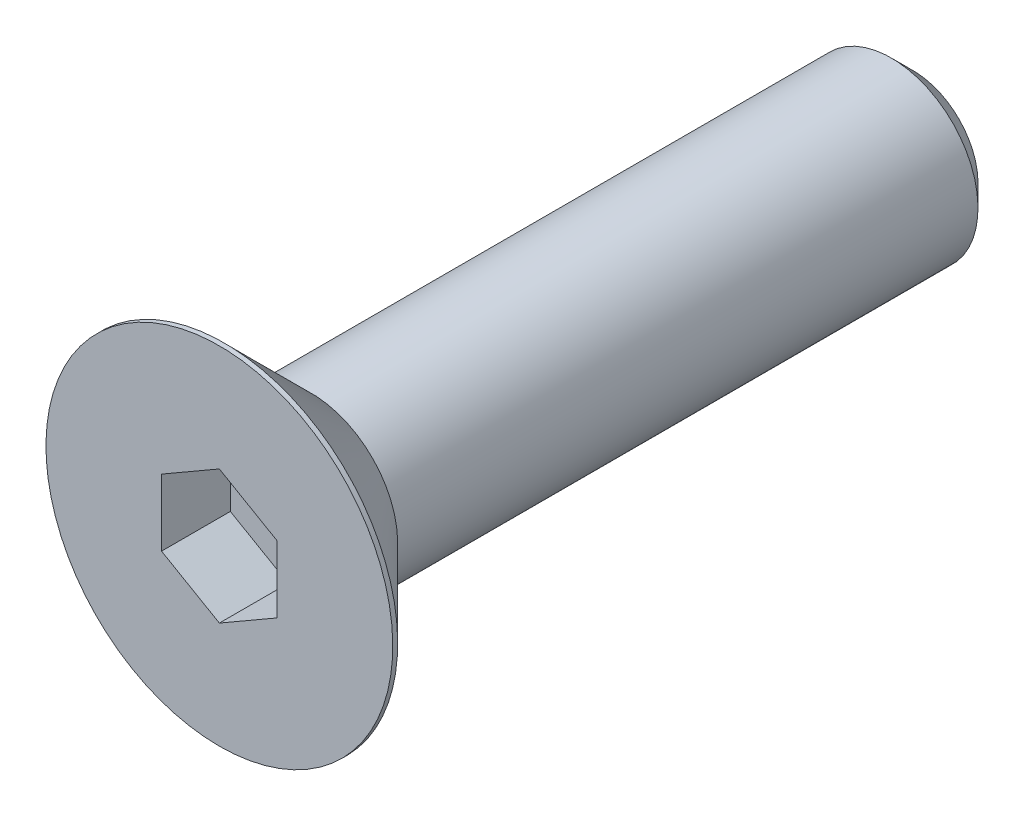
from build123d import *

# Parameters (mm, degrees)
CHAMFER1_SIZE      = 0.375
CUT_EXTRUDE2_DEPTH = 1.19


with BuildPart() as part:
    # Sketch1 → Revolve1 (revolve)
    with BuildSketch(Plane(origin=(0, 0, 0), x_dir=(0, 0, -1), z_dir=(1, 0, 0))):
        Polygon((-4.3, 1.5), (6, 1.5), (6, 0), (-4.81, 0), (-4.81, 1.5), align=None)
    revolve(axis=Axis((0, 0, 4.81), (0, 0, -1)))

    # Chamfer1
    chamfer1_edges = [part.edges().sort_by_distance(p)[0] for p in [
        (0, -1.5, -6),
    ]]
    chamfer(chamfer1_edges, length=CHAMFER1_SIZE)


with BuildPart() as body_2:
    # Sketch7 → Revolve2 (revolve)
    with BuildSketch(Plane(origin=(0, 0, 0), x_dir=(0, 0, -1), z_dir=(1, 0, 0))):
        Polygon((-5.915, 3), (-6, 3), (-6, 0), (-4.3, 0), (-4.3, 1.385), align=None)
    revolve(axis=Axis((0, 0, 6), (0, 0, -1)))

    # Sketch5 → Cut-Extrude2 (cut)
    with BuildSketch(Plane.XY.offset(6)):
        Polygon((1, -0.577350269), (1, 0.577350269), (0, 1.154700538), (-1, 0.577350269), (-1, -0.577350269), (0, -1.154700538), align=None)
    extrude(amount=-CUT_EXTRUDE2_DEPTH, mode=Mode.SUBTRACT)


solid = Compound([part.part, body_2.part])
